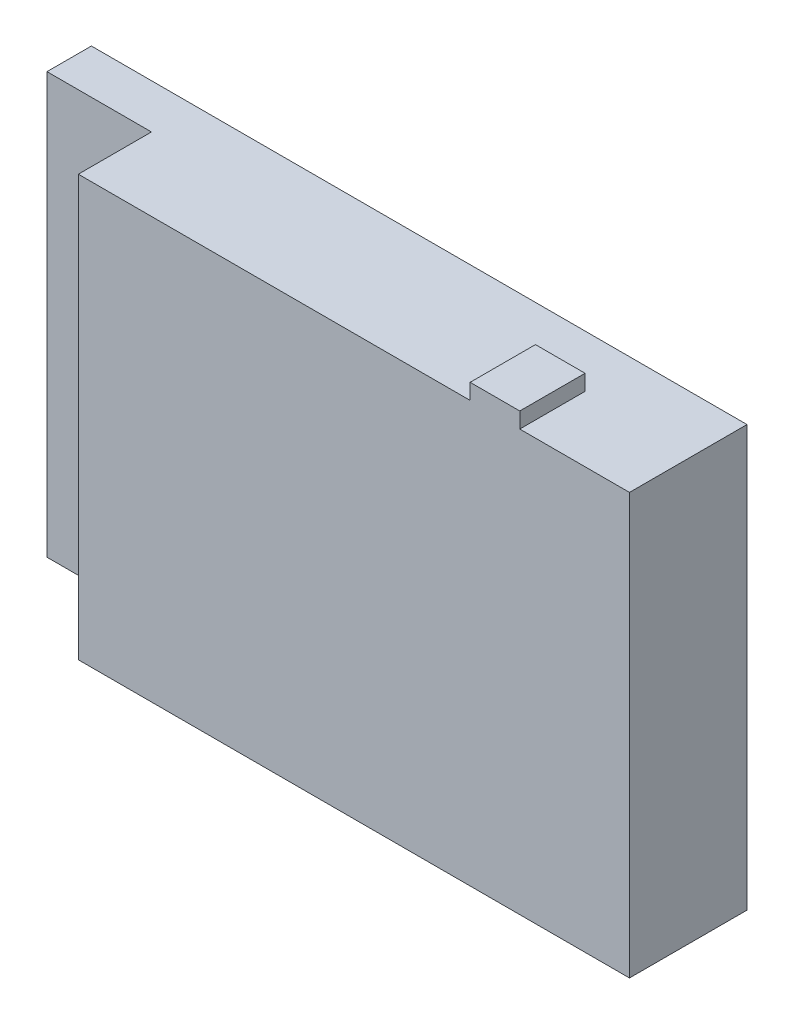
from build123d import *

# Parameters (mm, degrees)
SKETCH_1_W          = 25.1
SKETCH_1_H          = 16.1
SKETCH_1_W_2        = 1.9
SKETCH_1_H_2        = 0.6
EXTRUDE_1_DEPTH     = 4.5
SKETCH_2_W          = 1.9
SKETCH_2_H          = 0.6
CUT_EXTRUDE_1_DEPTH = 2
SKETCH_3_W          = 4
SKETCH_3_H          = 16.1
CUT_EXTRUDE_2_DEPTH = 2.8


with BuildPart() as part:
    # 草图1 → 凸台-拉伸1 (new body)
    with BuildSketch(Plane.XY):
        Rectangle(SKETCH_1_W, SKETCH_1_H)
        with Locations((7.4, 8.35)):
            Rectangle(SKETCH_1_W_2, SKETCH_1_H_2)
    extrude(amount=EXTRUDE_1_DEPTH)

    # 草图2 → 切除-拉伸1 (cut)
    with BuildSketch(Plane(origin=(0, 0, 0), x_dir=(-1, 0, 0), z_dir=(0, 0, -1))):
        with Locations((-7.4, 8.35)):
            Rectangle(SKETCH_2_W, SKETCH_2_H)
    extrude(amount=-CUT_EXTRUDE_1_DEPTH, mode=Mode.SUBTRACT)

    # 草图3 → 切除-拉伸2 (cut)
    with BuildSketch(Plane.XY.offset(4.5)):
        with Locations((-10.55, 0)):
            Rectangle(SKETCH_3_W, SKETCH_3_H)
    extrude(amount=-CUT_EXTRUDE_2_DEPTH, mode=Mode.SUBTRACT)


solid = part.part
